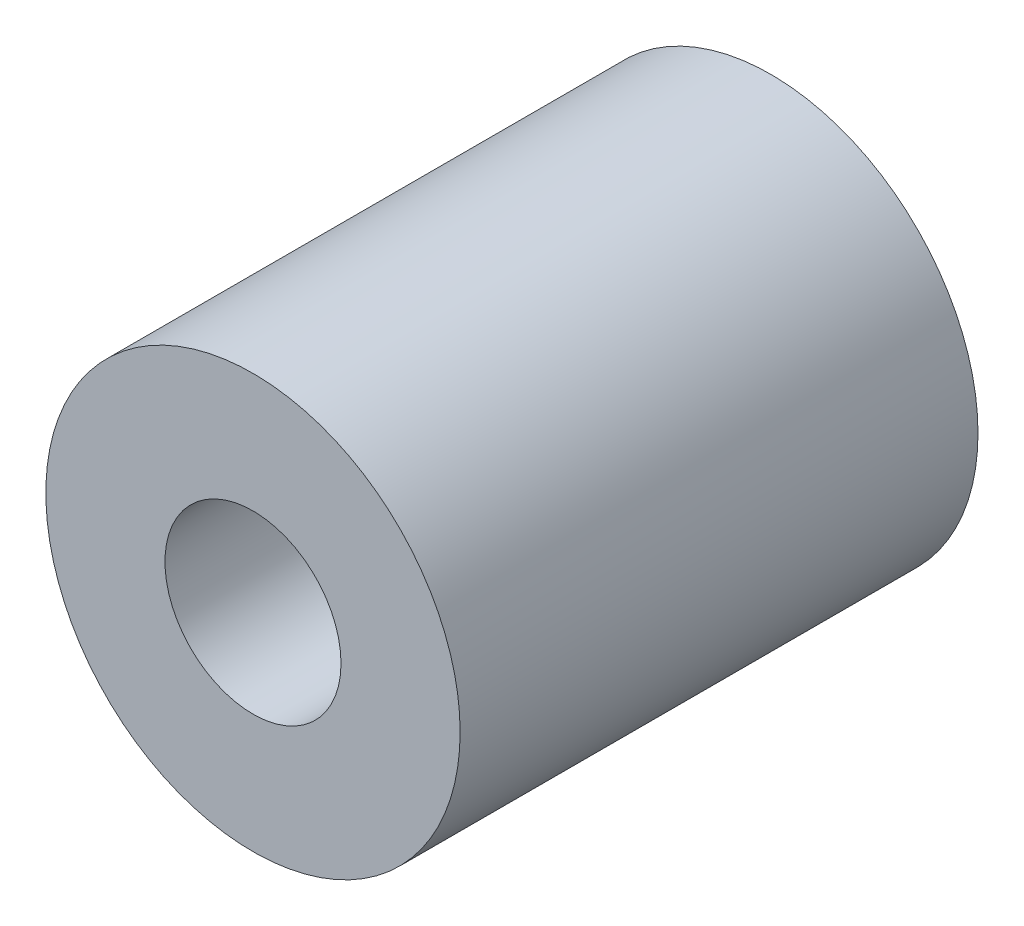
from build123d import *

# Parameters (mm, degrees)
SKETCH_1_R      = 4
SKETCH_1_R_2    = 1.7
EXTRUDE_1_DEPTH = 10


with BuildPart() as part:
    # 草图1 → 凸台-拉伸1 (new body)
    with BuildSketch(Plane.XY):
        Circle(SKETCH_1_R)
        Circle(SKETCH_1_R_2, mode=Mode.SUBTRACT)
    extrude(amount=EXTRUDE_1_DEPTH)


solid = part.part
